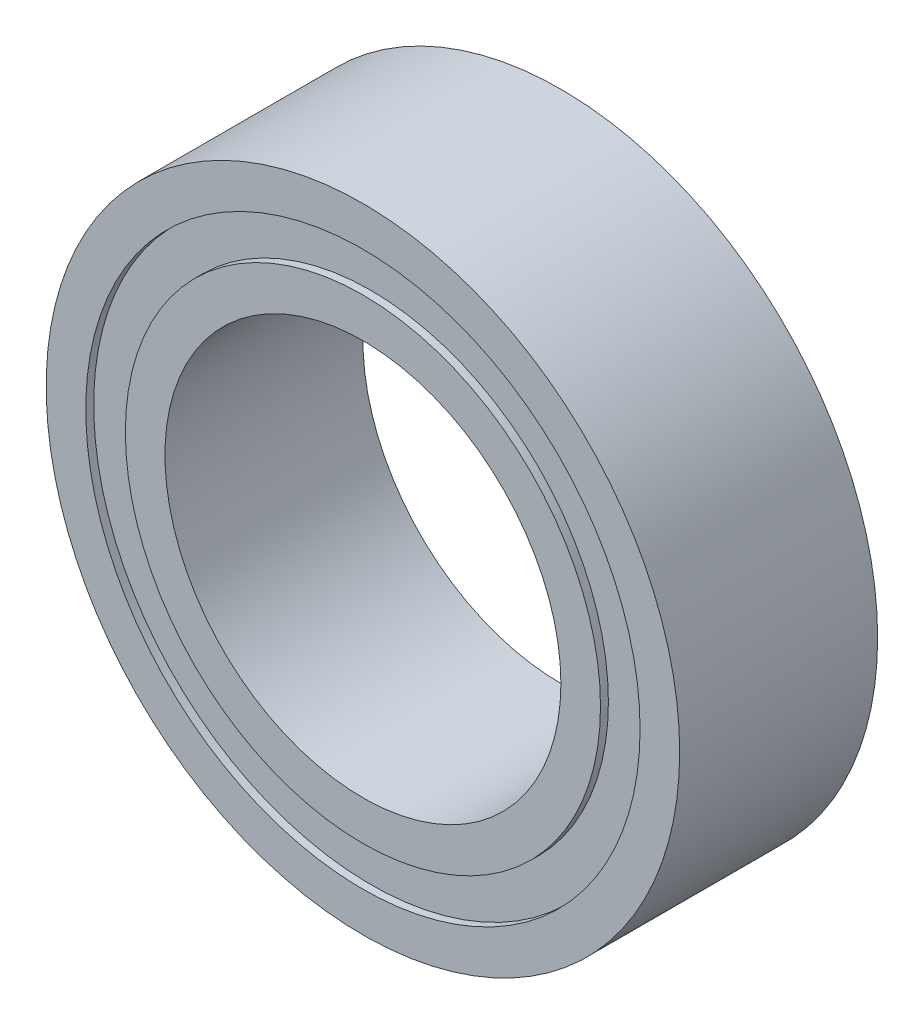
from build123d import *

# Parameters (mm, degrees)
SKETCH1_R           = 4
SKETCH1_R_2         = 2.5
BOSS_EXTRUDE1_DEPTH = 2.5
SKETCH2_R           = 3.5
SKETCH2_R_2         = 3
CUT_EXTRUDE1_DEPTH  = 0.1
CUT_EXTRUDE2_START  = -0.1
SKETCH3_R           = 3.5
SKETCH3_R_2         = 3
CUT_EXTRUDE2_DEPTH  = 0.1


with BuildPart() as part:
    # Sketch1 → Boss-Extrude1 (new body)
    with BuildSketch(Plane.XY):
        Circle(SKETCH1_R)
        Circle(SKETCH1_R_2, mode=Mode.SUBTRACT)
    extrude(amount=BOSS_EXTRUDE1_DEPTH)

    # Sketch2 → Cut-Extrude1 (cut)
    with BuildSketch(Plane(origin=(0, 0, 0), x_dir=(-1, 0, 0), z_dir=(0, 0, -1))):
        Circle(SKETCH2_R)
        Circle(SKETCH2_R_2, mode=Mode.SUBTRACT)
    extrude(amount=-CUT_EXTRUDE1_DEPTH, mode=Mode.SUBTRACT)

    # Sketch3 → Cut-Extrude2 (cut)
    with BuildSketch(Plane.XY.offset(2.5).offset(CUT_EXTRUDE2_START)):
        with Locations(Location((0, 0, 0), (0, 0, 180))):
            Circle(SKETCH3_R)
        with Locations(Location((0, 0, 0), (0, 0, 180))):
            Circle(SKETCH3_R_2, mode=Mode.SUBTRACT)
    extrude(amount=CUT_EXTRUDE2_DEPTH, mode=Mode.SUBTRACT)


solid = part.part
